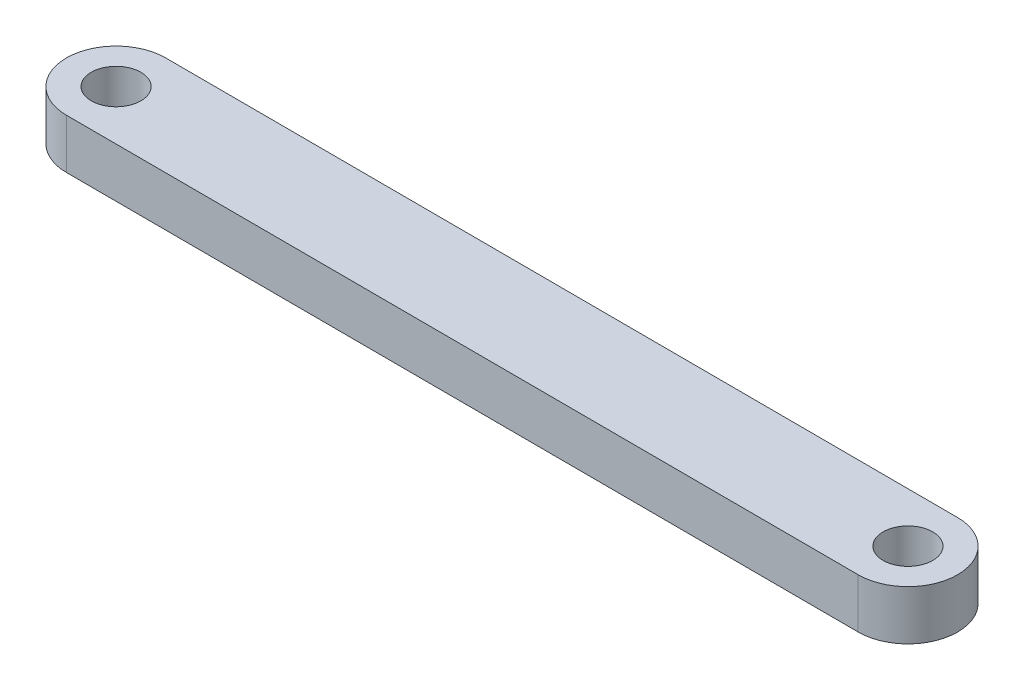
from build123d import *

# Parameters (mm, degrees)
BOSS_EXTRUDE1_DEPTH = 5
CUT_EXTRUDE1_REACH  = 86.899
SKETCH3_R           = 2.5


with BuildPart() as part:
    # Sketch2 → Boss-Extrude1 (new body)
    with BuildSketch(Plane(origin=(0, 0, 0), x_dir=(1, 0, 0), z_dir=(0, 1, 0))):
        with BuildLine():
            Line((-0.667440917, 1.660440165), (79.332559083, 1.449469701))
            ThreePointArc((79.332559083, 1.449469701), (84.319356089, -3.563698521), (79.306187867, -8.550495527))
            Line((79.306187867, -8.550495527), (-0.693812133, -8.339525063))
            ThreePointArc((-0.693812133, -8.339525063), (-5.680609139, -3.326356841), (-0.667440917, 1.660440165))
        make_face()
    extrude(amount=BOSS_EXTRUDE1_DEPTH)

    # Sketch3 → Cut-Extrude1 (cut, up to next)
    with BuildSketch(Plane(origin=(0, 5, 0), x_dir=(1, 0, 0), z_dir=(0, 1, 0)), mode=Mode.PRIVATE) as cut_extrude1_sk1:
        with Locations(Location((-0.680626525, -3.339542449, 0), (0, 0, 270))):
            Circle(SKETCH3_R)
    cut_extrude1_tool1 = extrude(cut_extrude1_sk1.sketch, amount=-CUT_EXTRUDE1_REACH, mode=Mode.PRIVATE) & part.part
    # Sketch3 → Cut-Extrude1 (cut, up to next)
    with BuildSketch(Plane(origin=(0, 5, 0), x_dir=(1, 0, 0), z_dir=(0, 1, 0)), mode=Mode.PRIVATE) as cut_extrude1_sk2:
        with Locations(Location((79.319373475, -3.550512913, 0), (0, 0, 270))):
            Circle(SKETCH3_R)
    cut_extrude1_tool2 = extrude(cut_extrude1_sk2.sketch, amount=-CUT_EXTRUDE1_REACH, mode=Mode.PRIVATE) & part.part
    add(cut_extrude1_tool1.solids().sort_by_distance((-0.680627, 5, 3.339542))[0], mode=Mode.SUBTRACT)
    add(cut_extrude1_tool2.solids().sort_by_distance((79.319373, 5, 3.550513))[0], mode=Mode.SUBTRACT)


solid = part.part
